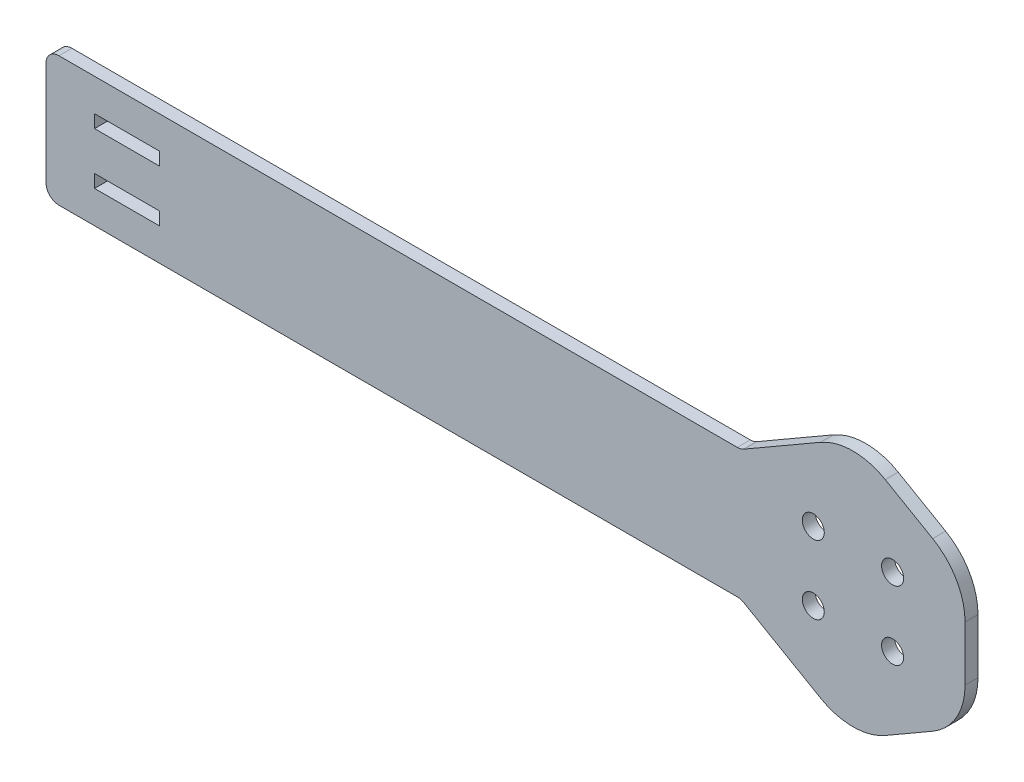
from build123d import *

# Parameters (mm, degrees)
SKETCH1_W           = 107.330973451
SKETCH1_H           = 20
SKETCH1_W_2         = 10
SKETCH1_H_2         = 2
SKETCH1_R           = 12.25
SKETCH1_R_2         = 1.7
BOSS_EXTRUDE3_DEPTH = 2
FILLET5_R           = 10
FILLET6_R           = 10
FILLET7_R           = 10
FILLET8_R           = 10
FILLET14_R          = 2
FILLET15_R          = 2
FILLET16_R          = 2


with BuildPart() as part:
    # Sketch1 → Boss-Extrude3 (new body)
    # profile 1 of 4: a face of its own
    with BuildSketch(Plane.XY):
        with Locations((53.665486726, -20)):
            Rectangle(SKETCH1_W, SKETCH1_H)
        with Locations((12.5, -24)):
            Rectangle(SKETCH1_W_2, SKETCH1_H_2, mode=Mode.SUBTRACT)
        with Locations((12.5, -16)):
            Rectangle(SKETCH1_W_2, SKETCH1_H_2, mode=Mode.SUBTRACT)
    # profile 2 of 4: a face of its own
    with BuildSketch(Plane.XY):
        Polygon((140, -8.861471272), (124.651481526, 0), (107.330973451, -10), (107.330973451, -30), (124.651481526, -40), (140, -31.138528728), align=None)
        with Locations((124.651481526, -20)):
            Circle(SKETCH1_R, mode=Mode.SUBTRACT)
    # profile 3 of 4: a face of its own
    with BuildSketch(Plane.XY):
        with Locations((124.651481526, -20)):
            Circle(SKETCH1_R)
        with Locations((118.526481526, -25.304405598)):
            Circle(SKETCH1_R_2, mode=Mode.SUBTRACT)
        with Locations((130.776481526, -25.304405598)):
            Circle(SKETCH1_R_2, mode=Mode.SUBTRACT)
        with Locations((130.776481526, -14.695594402)):
            Circle(SKETCH1_R_2, mode=Mode.SUBTRACT)
        with Locations((118.526481526, -14.695594402)):
            Circle(SKETCH1_R_2, mode=Mode.SUBTRACT)
    # profile 4 of 4: a face of its own
    with BuildSketch(Plane.XY):
        Polygon((141.971989602, -10), (140, -8.861471272), (140, -31.138528728), (141.971989602, -30), align=None)
    extrude(amount=BOSS_EXTRUDE3_DEPTH)

    # Fillet5
    fillet5_edges = [part.edges().sort_by_distance(p)[0] for p in [
        (124.651481526, 0, 1),
    ]]
    fillet(fillet5_edges, radius=FILLET5_R)

    # Fillet6
    fillet6_edges = [part.edges().sort_by_distance(p)[0] for p in [
        (141.971989602, -10, 1),
    ]]
    fillet(fillet6_edges, radius=FILLET6_R)

    # Fillet7
    fillet7_edges = [part.edges().sort_by_distance(p)[0] for p in [
        (141.971989602, -30, 1),
    ]]
    fillet(fillet7_edges, radius=FILLET7_R)

    # Fillet8
    fillet8_edges = [part.edges().sort_by_distance(p)[0] for p in [
        (124.651481526, -40, 1),
    ]]
    fillet(fillet8_edges, radius=FILLET8_R)

    # Fillet14
    fillet14_edges = [part.edges().sort_by_distance(p)[0] for p in [
        (0, -30, 1),
        (0, -10, 1),
    ]]
    fillet(fillet14_edges, radius=FILLET14_R)

    # Fillet15
    fillet15_edges = [part.edges().sort_by_distance(p)[0] for p in [
        (107.330973451, -10, 1),
    ]]
    fillet(fillet15_edges, radius=FILLET15_R)

    # Fillet16
    fillet16_edges = [part.edges().sort_by_distance(p)[0] for p in [
        (107.330973451, -30, 1),
    ]]
    fillet(fillet16_edges, radius=FILLET16_R)


solid = part.part
